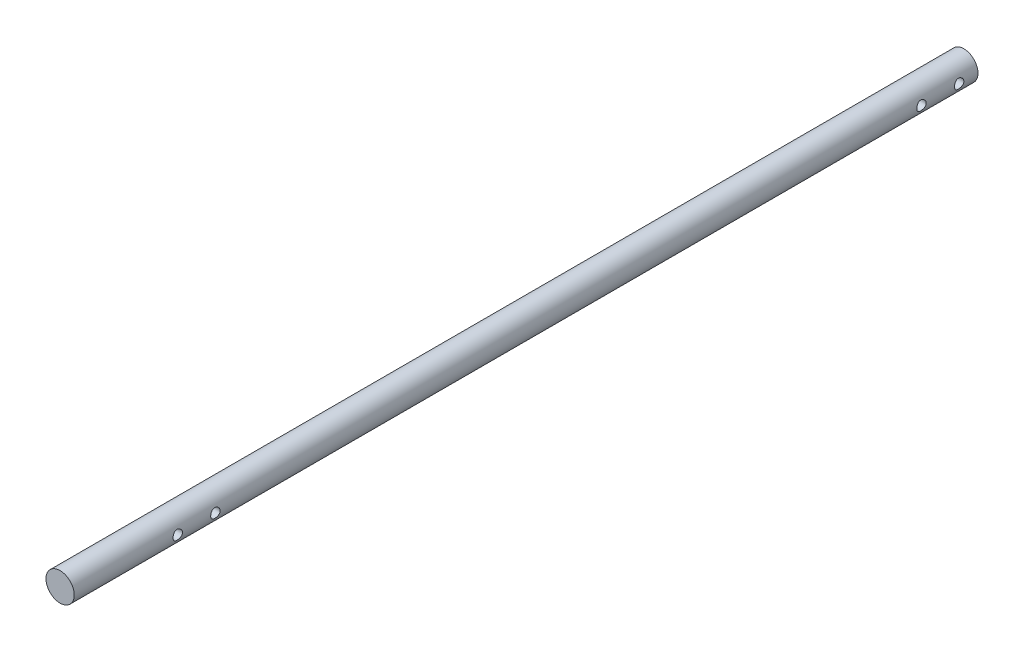
from build123d import *

# Parameters (mm, degrees)
SKETCH1_R                       = 9.525
BOSS_EXTRUDE1_DEPTH             = 609.6
F_1_4_0_25_DIAMETER_HOLE1_D     = 6.35
F_1_4_0_25_DIAMETER_HOLE1_DEPTH = 25.399
F_1_4_0_25_DIAMETER_HOLE1_TIP   = 1.907732465
F_1_4_0_25_DIAMETER_HOLE2_D     = 6.35
F_1_4_0_25_DIAMETER_HOLE2_DEPTH = 25.4
F_1_4_0_25_DIAMETER_HOLE2_TIP   = 1.907732465


with BuildPart() as part:
    # Sketch1 → Boss-Extrude1 (new body)
    with BuildSketch(Plane.XY):
        with Locations(Location((0, 0, 0), (0, 0, 180))):
            Circle(SKETCH1_R)
    extrude(amount=BOSS_EXTRUDE1_DEPTH)

    # 1/4 (0.25) Diameter Hole1
    with Locations(Plane(origin=(-12.7, 0, 514.35), x_dir=(0, 0, -1), z_dir=(-1, 0, 0))):
        with Locations((0, 0), (-25.4, 0)):
            Hole(F_1_4_0_25_DIAMETER_HOLE1_D / 2, depth=F_1_4_0_25_DIAMETER_HOLE1_DEPTH)
            with Locations((0, 0, -(F_1_4_0_25_DIAMETER_HOLE1_DEPTH + F_1_4_0_25_DIAMETER_HOLE1_TIP / 2))):  # 118° drill point
                Cone(0, F_1_4_0_25_DIAMETER_HOLE1_D / 2, F_1_4_0_25_DIAMETER_HOLE1_TIP, mode=Mode.SUBTRACT)

    # 1/4 (0.25) Diameter Hole2
    with Locations(Plane(origin=(-12.7, 0, 38.1), x_dir=(0, 0, -1), z_dir=(-1, 0, 0))):
        with Locations((0, 0), (25.4, 0)):
            Hole(F_1_4_0_25_DIAMETER_HOLE2_D / 2, depth=F_1_4_0_25_DIAMETER_HOLE2_DEPTH)
            with Locations((0, 0, -(F_1_4_0_25_DIAMETER_HOLE2_DEPTH + F_1_4_0_25_DIAMETER_HOLE2_TIP / 2))):  # 118° drill point
                Cone(0, F_1_4_0_25_DIAMETER_HOLE2_D / 2, F_1_4_0_25_DIAMETER_HOLE2_TIP, mode=Mode.SUBTRACT)


solid = part.part
